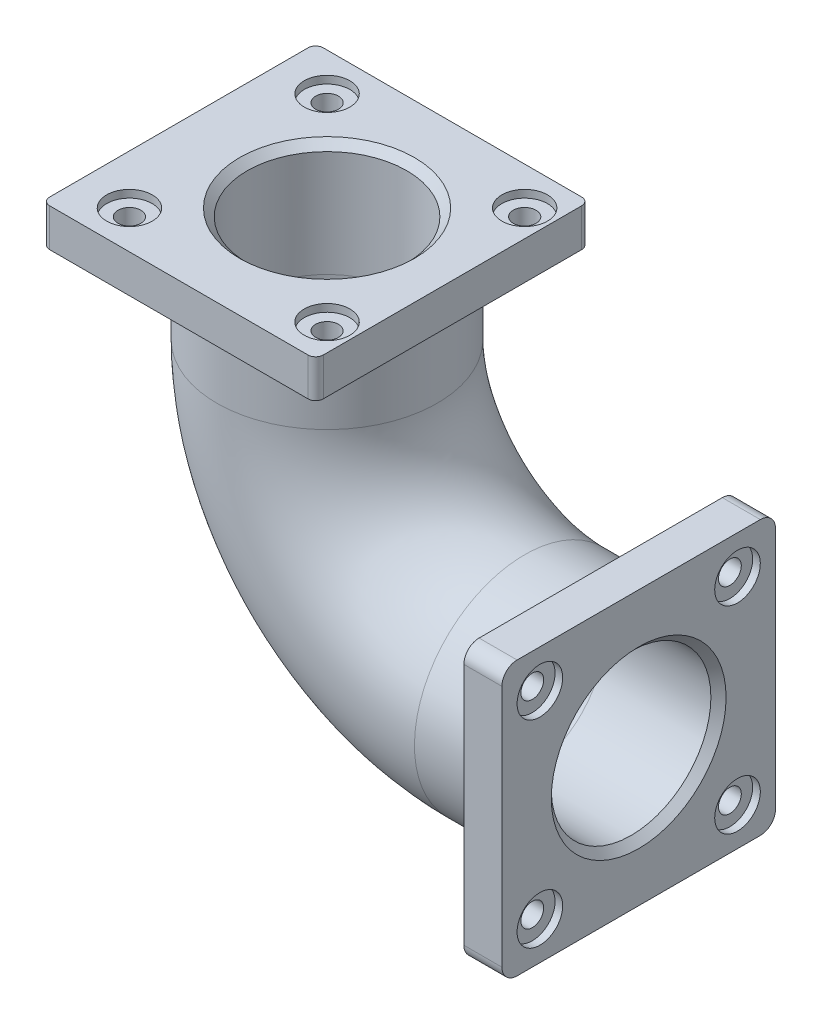
from build123d import *

# Parameters (mm, degrees)
SKETCH2_R           = 145
SKETCH2_R_2         = 105
BOSS_EXTRUDE2_START = -50
SKETCH3_W           = 360
SKETCH3_H           = 360
SKETCH3_R           = 145
BOSS_EXTRUDE2_DEPTH = 50
FILLET4_R           = 20
SKETCH4_R           = 145
BOSS_EXTRUDE3_DEPTH = 50
SKETCH6_R           = 30
CUT_EXTRUDE1_DEPTH  = 10
CUT_EXTRUDE2_REACH  = 746.668
SKETCH7_R           = 15
CIRPATTERN1_COUNT   = 4
SKETCH9_R           = 30
CUT_EXTRUDE4_DEPTH  = 10
CUT_EXTRUDE5_REACH  = 866.02
SKETCH11_R          = 15
CIRPATTERN3_COUNT   = 4
CHAMFER1_SIZE       = 10


with BuildPart() as part:
    # Sweep-Thin1: sweep along a path in Sketch1
    with BuildLine(Plane.XY) as sweep_thin1_path:
        Line((0, 0), (-150, 0))
        ThreePointArc((-150, 0), (-333.847763109, 76.152236891), (-410, 260))
        Line((-410, 260), (-410, 410))
    # Sketch2 → Sweep-Thin1 (sweep)
    with BuildSketch(Plane(origin=(0, 0, 0), x_dir=(0, 0, -1), z_dir=(1, 0, 0))):
        Circle(SKETCH2_R)
        Circle(SKETCH2_R_2, mode=Mode.SUBTRACT)
    sweep(path=sweep_thin1_path.line)

    # Sketch3 → Boss-Extrude2 (add)
    with BuildSketch(Plane(origin=(0, 0, 0), x_dir=(0, 0, -1), z_dir=(1, 0, 0)).offset(BOSS_EXTRUDE2_START)):
        Rectangle(SKETCH3_W, SKETCH3_H)
        with Locations(Location((0, 0, 0), (0, 0, 270))):
            Circle(SKETCH3_R, mode=Mode.SUBTRACT)
    extrude(amount=BOSS_EXTRUDE2_DEPTH)

    # Fillet4
    fillet4_edges = [part.edges().sort_by_distance(p)[0] for p in [
        (-25, 180, -180),
        (-25, -180, -180),
        (-25, -180, 180),
        (-25, 180, 180),
    ]]
    fillet(fillet4_edges, radius=FILLET4_R)

    # Sketch4 → Boss-Extrude3 (add)
    with BuildSketch(Plane(origin=(0, 410, 0), x_dir=(1, 0, 0), z_dir=(0, 1, 0))):
        with BuildLine():
            Line((-255.005170931, 180), (-595.005170931, 180))
            ThreePointArc((-595.005170931, 180), (-602.076238742, 177.071067812), (-605.005170931, 170))
            Line((-605.005170931, 170), (-605.005170931, -170))
            ThreePointArc((-605.005170931, -170), (-602.076238742, -177.071067812), (-595.005170931, -180))
            Line((-595.005170931, -180), (-255.005170931, -180))
            ThreePointArc((-255.005170931, -180), (-247.934103119, -177.071067812), (-245.005170931, -170))
            Line((-245.005170931, -170), (-245.005170931, 170))
            ThreePointArc((-245.005170931, 170), (-247.934103119, 177.071067812), (-255.005170931, 180))
        make_face()
        with Locations(Location((-410, 0, 0), (0, 0, 180))):
            Circle(SKETCH4_R, mode=Mode.SUBTRACT)
    extrude(amount=-BOSS_EXTRUDE3_DEPTH)

    # Sketch6 → Cut-Extrude1 (cut)
    with BuildSketch(Plane(origin=(0, 0, 0), x_dir=(0, 0, -1), z_dir=(1, 0, 0))):
        with Locations((-130, 130)):
            Circle(SKETCH6_R)
    cut_extrude1 = extrude(amount=-CUT_EXTRUDE1_DEPTH, mode=Mode.SUBTRACT)

    # Sketch7 → Cut-Extrude2 (cut, up to next)
    with BuildSketch(Plane(origin=(-10, 0, 0), x_dir=(0, 0, -1), z_dir=(1, 0, 0)), mode=Mode.PRIVATE) as cut_extrude2_sk1:
        with Locations((-130, 130)):
            Circle(SKETCH7_R)
    cut_extrude2_tool1 = extrude(cut_extrude2_sk1.sketch, amount=-CUT_EXTRUDE2_REACH, mode=Mode.PRIVATE) & part.part
    cut_extrude2 = cut_extrude2_tool1.solids().sort_by_distance((-10, 130, 130))[0]
    add(cut_extrude2, mode=Mode.SUBTRACT)

    # CirPattern1: Cut-Extrude1, Cut-Extrude2 ×4 about axis
    cirpattern1_axis = Axis((0, 0, 0), (1, 0, 0))
    add([cut_extrude1.rotate(cirpattern1_axis, i * 360 / CIRPATTERN1_COUNT) for i in range(1, CIRPATTERN1_COUNT)], mode=Mode.SUBTRACT)
    add([cut_extrude2.rotate(cirpattern1_axis, i * 360 / CIRPATTERN1_COUNT) for i in range(1, CIRPATTERN1_COUNT)], mode=Mode.SUBTRACT)

    # Sketch9 → Cut-Extrude4 (cut)
    with BuildSketch(Plane(origin=(0, 410, 0), x_dir=(1, 0, 0), z_dir=(0, 1, 0))):
        with Locations(Location((-540, 130, 0), (0, 0, 180))):
            Circle(SKETCH9_R)
    cut_extrude4 = extrude(amount=-CUT_EXTRUDE4_DEPTH, mode=Mode.SUBTRACT)

    # Sketch11 → Cut-Extrude5 (cut, up to next)
    with BuildSketch(Plane(origin=(0, 410, 0), x_dir=(1, 0, 0), z_dir=(0, 1, 0)), mode=Mode.PRIVATE) as cut_extrude5_sk1:
        with Locations(Location((-540, 130, 0), (0, 0, 180))):
            Circle(SKETCH11_R)
    cut_extrude5_tool1 = extrude(cut_extrude5_sk1.sketch, amount=-CUT_EXTRUDE5_REACH, mode=Mode.PRIVATE) & part.part
    cut_extrude5 = cut_extrude5_tool1.solids().sort_by_distance((-540, 410, -130))[0]
    add(cut_extrude5, mode=Mode.SUBTRACT)

    # CirPattern3: Cut-Extrude4, Cut-Extrude5 ×4 about axis
    cirpattern3_axis = Axis((-410, 0, 0), (0, 1, 0))
    add([cut_extrude4.rotate(cirpattern3_axis, i * 360 / CIRPATTERN3_COUNT) for i in range(1, CIRPATTERN3_COUNT)], mode=Mode.SUBTRACT)
    add([cut_extrude5.rotate(cirpattern3_axis, i * 360 / CIRPATTERN3_COUNT) for i in range(1, CIRPATTERN3_COUNT)], mode=Mode.SUBTRACT)

    # Chamfer1
    chamfer1_edges = [part.edges().sort_by_distance(p)[0] for p in [
        (0, 0, 105),
        (-410, 410, 105),
    ]]
    chamfer(chamfer1_edges, length=CHAMFER1_SIZE)


solid = part.part
